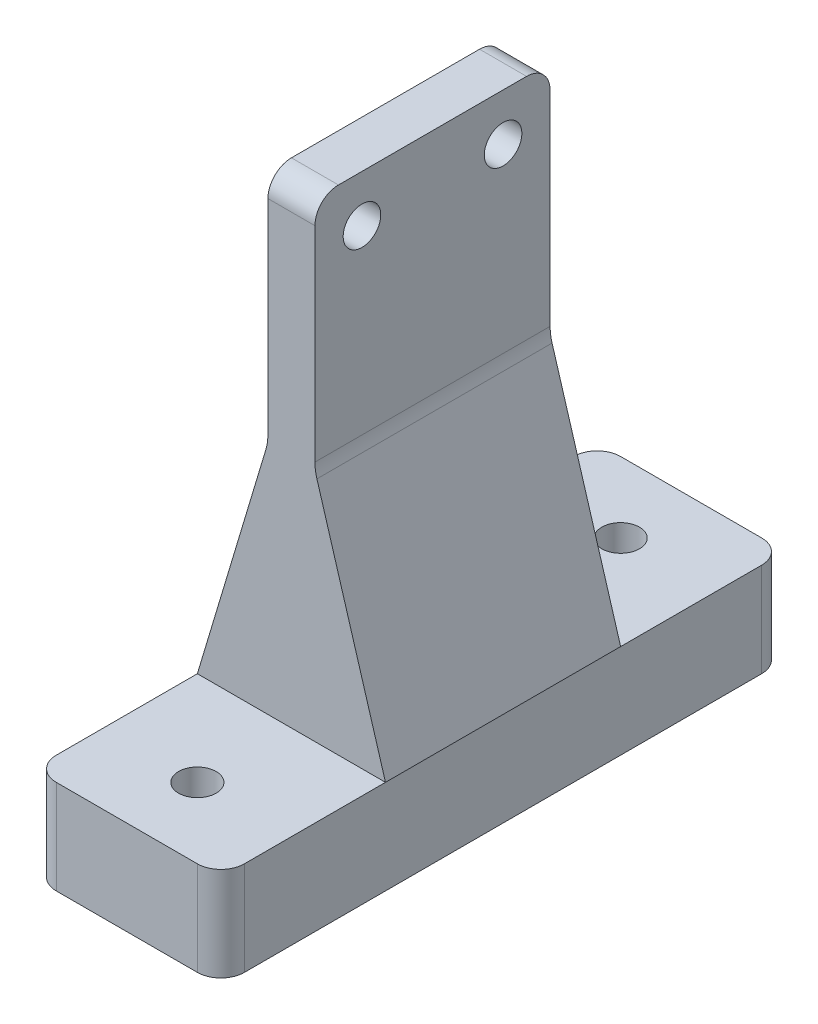
from build123d import *

# Parameters (mm, degrees)
BOSS_EXTRUDE1_DEPTH = 20
SKETCH2_W           = 10
SKETCH2_H           = 50
BOSS_EXTRUDE2_DEPTH = 100
SKETCH4_R           = 4
CUT_EXTRUDE2_DEPTH  = 125.599357944
FILLET1_R           = 5
SKETCH7_R           = 4
CUT_EXTRUDE3_DEPTH  = 142.155942135
BOSS_EXTRUDE3_DEPTH = 50
FILLET2_R           = 10
BOSS_EXTRUDE4_DEPTH = 50
FILLET3_R           = 10


with BuildPart() as part:
    # Sketch1 → Boss-Extrude1 (new body)
    with BuildSketch(Plane(origin=(0, 0, 0), x_dir=(1, 0, 0), z_dir=(0, 1, 0))):
        Polygon((-25, 45), (-25, 30), (-25, -30), (-25, -50), (15, -50), (15, -30), (15, 30), (15, 70), (-25, 70), align=None)
    extrude(amount=BOSS_EXTRUDE1_DEPTH)

    # Sketch2 → Boss-Extrude2 (add)
    with BuildSketch(Plane(origin=(0, 20, 0), x_dir=(1, 0, 0), z_dir=(0, 1, 0))):
        with Locations((-5, 10)):
            Rectangle(SKETCH2_W, SKETCH2_H)
    extrude(amount=BOSS_EXTRUDE2_DEPTH)

    # Sketch4 → Cut-Extrude2 (cut, through all)
    with BuildSketch(Plane(origin=(0, 20, 0), x_dir=(1, 0, 0), z_dir=(0, 1, 0))):
        with Locations(Location((-5, 55, 0), (0, 0, 270))):
            Circle(SKETCH4_R)
        with Locations(Location((-5, -35, 0), (0, 0, 270))):
            Circle(SKETCH4_R)
    extrude(amount=-CUT_EXTRUDE2_DEPTH, mode=Mode.SUBTRACT)

    # Fillet1
    fillet1_edges = [part.edges().sort_by_distance(p)[0] for p in [
        (-25, 10, -70),
        (15, 10, -70),
        (15, 10, 50),
        (-25, 10, 50),
        (-5, 120, 15),
        (-5, 120, -35),
    ]]
    fillet(fillet1_edges, radius=FILLET1_R)

    # Sketch7 → Cut-Extrude3 (cut, through all)
    with BuildSketch(Plane.ZY.offset(10)):
        with Locations((-25, 110)):
            Circle(SKETCH7_R)
        with Locations((5, 110)):
            Circle(SKETCH7_R)
    extrude(amount=-CUT_EXTRUDE3_DEPTH, mode=Mode.SUBTRACT)

    # Sketch9 → Boss-Extrude3 (add)
    with BuildSketch(Plane.XY.offset(15)):
        Polygon((-10, 20), (-25, 20), (-10, 70), align=None)
    extrude(amount=-BOSS_EXTRUDE3_DEPTH)

    # Fillet2
    fillet2_edges = [part.edges().sort_by_distance(p)[0] for p in [
        (-10, 70, -10),
    ]]
    fillet(fillet2_edges, radius=FILLET2_R)

    # Sketch10 → Boss-Extrude4 (add)
    with BuildSketch(Plane.XY.offset(15)):
        Polygon((0, 20), (15, 20), (0, 70), align=None)
    extrude(amount=-BOSS_EXTRUDE4_DEPTH)

    # Fillet3
    fillet3_edges = [part.edges().sort_by_distance(p)[0] for p in [
        (0, 70, -10),
    ]]
    fillet(fillet3_edges, radius=FILLET3_R)


solid = part.part
